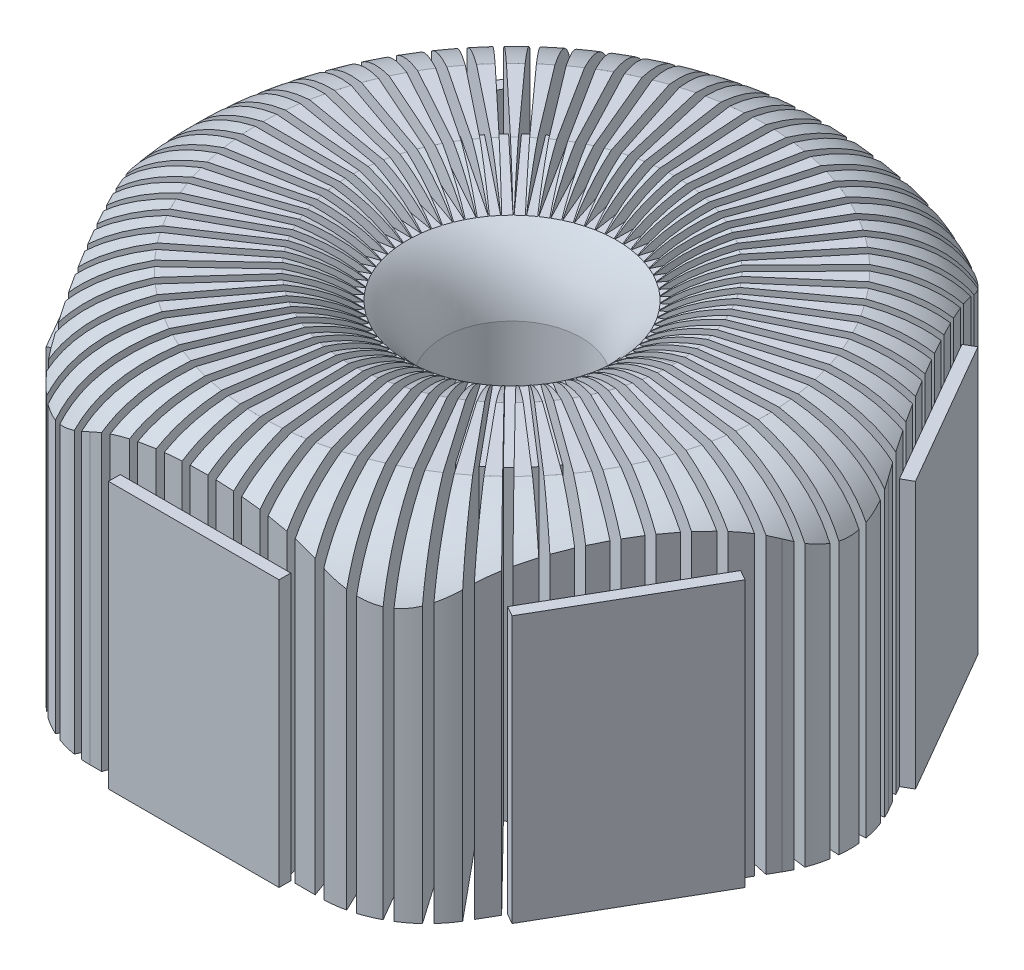
from build123d import *

# Parameters (mm, degrees)
BOSS_EXTRUDE2_DEPTH = 62.5
SKETCH6_R           = 13
CUT_EXTRUDE1_DEPTH  = 62.5
CUT_EXTRUDE2_DEPTH  = 0.75
CIRPATTERN1_COUNT   = 75
SKETCH9_W           = 16
SKETCH9_H           = 2.2
SKETCH9_W_2         = 32
BOSS_EXTRUDE3_DEPTH = 50


with BuildPart() as part:
    # Sketch1 → Boss-Extrude2 (new body)
    with BuildSketch(Plane(origin=(0, 0, 0), x_dir=(1, 0, 0), z_dir=(0, 1, 0))):
        with BuildLine():
            Line((60.621778265, 10), (38.97114317, 47.5))
            ThreePointArc((38.97114317, 47.5), (31.650635095, 54.820508076), (21.650635095, 57.5))
            Line((21.650635095, 57.5), (-21.650635095, 57.5))
            ThreePointArc((-21.650635095, 57.5), (-31.650635095, 54.820508076), (-38.97114317, 47.5))
            Line((-38.97114317, 47.5), (-60.621778265, 10))
            ThreePointArc((-60.621778265, 10), (-63.301270189, 0), (-60.621778265, -10))
            Line((-60.621778265, -10), (-38.97114317, -47.5))
            ThreePointArc((-38.97114317, -47.5), (-31.650635095, -54.820508076), (-21.650635095, -57.5))
            Line((-21.650635095, -57.5), (21.650635095, -57.5))
            ThreePointArc((21.650635095, -57.5), (31.650635095, -54.820508076), (38.97114317, -47.5))
            Line((38.97114317, -47.5), (60.621778265, -10))
            ThreePointArc((60.621778265, -10), (63.301270189, 0), (60.621778265, 10))
        make_face()
    extrude(amount=BOSS_EXTRUDE2_DEPTH)

    # Sketch6 → Cut-Extrude1 (cut)
    with BuildSketch(Plane(origin=(0, 62.5, 0), x_dir=(1, 0, 0), z_dir=(0, 1, 0))):
        with Locations(Location((0, 0, 0), (0, 0, 270))):
            Circle(SKETCH6_R)
    extrude(amount=-CUT_EXTRUDE1_DEPTH, mode=Mode.SUBTRACT)

    # Sketch7 → Cut-Revolve1 (revolve, cut)
    with BuildSketch(Plane.XY, mode=Mode.PRIVATE) as cut_revolve1_sk:
        with BuildLine():
            Line((13, 62.5), (13, 45))
            add(Edge.make_bspline(
                [(13, 45), (15.111636893, 59.052507389), (30.5, 62.5)],
                knots=[0, 0, 0, 1, 1, 1], degree=2))
            Line((30.5, 62.5), (13, 62.5))
        make_face()
        with BuildLine():
            Line((64.942286341, 62.5), (47.442286341, 62.5))
            add(Edge.make_bspline(
                [(64.942286341, 45), (62.830649448, 59.052507389), (47.442286341, 62.5)],
                knots=[0, 0, 0, 1, 1, 1], degree=2))
            Line((64.942286341, 45), (64.942286341, 62.5))
        make_face()
    revolve(cut_revolve1_sk.sketch.rotate(Axis((0, 62.5, 0), (0, -1, 0)), 90), axis=Axis((0, 62.5, 0), (0, -1, 0)), mode=Mode.SUBTRACT)

    # Sketch8 → Cut-Extrude2 (cut, symmetric)
    with BuildSketch(Plane.XY):
        Polygon((-63.301270189, 62.5), (-63.301270189, 0), (-38.301270189, 0), (-38.301270189, 5), (-38.301270189, 57.5), (-13.301270189, 57.5), (-13.301270189, 62.5), align=None)
    cut_extrude2 = extrude(amount=CUT_EXTRUDE2_DEPTH, both=True, mode=Mode.SUBTRACT)

    # CirPattern1: Cut-Extrude2 ×75 about axis
    cirpattern1_axis = Axis((0, 0, 0), (0, 1, 0))
    for i in range(1, CIRPATTERN1_COUNT):
        add(cut_extrude2.rotate(cirpattern1_axis, i * 360 / CIRPATTERN1_COUNT), mode=Mode.SUBTRACT)

    # Sketch9 → Boss-Extrude3 (add)
    with BuildSketch(Plane(origin=(0, 0, 0), x_dir=(1, 0, 0), z_dir=(0, 1, 0))):
        with Locations((-8, 58.6)):
            Rectangle(SKETCH9_W, SKETCH9_H)
        with Locations((8, 58.6)):
            Rectangle(SKETCH9_W, SKETCH9_H)
        with Locations((0, -58.6)):
            Rectangle(SKETCH9_W_2, SKETCH9_H)
        Polygon((-59.701716606, -15.993593539), (-43.701716606, -43.706406461), (-41.796460718, -42.606406461), (-57.796460718, -14.893593539), align=None)
        Polygon((-43.701716606, 43.706406461), (-59.701716606, 15.993593539), (-57.796460718, 14.893593539), (-41.796460718, 42.606406461), align=None)
        Polygon((57.796460718, 14.893593539), (41.796460718, 42.606406461), (43.701716606, 43.706406461), (59.701716606, 15.993593539), align=None)
        Polygon((43.701716606, -43.706406461), (59.701716606, -15.993593539), (57.796460718, -14.893593539), (41.796460718, -42.606406461), align=None)
    extrude(amount=BOSS_EXTRUDE3_DEPTH)


solid = part.part
